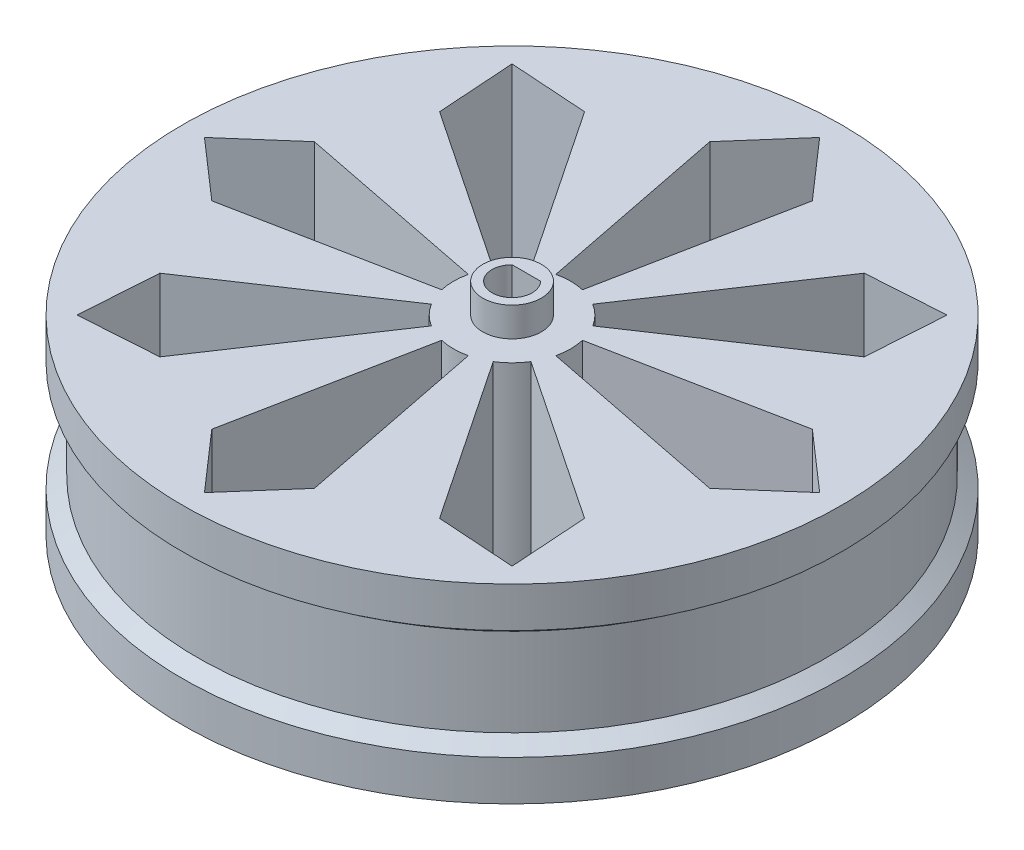
from build123d import *

# Parameters (mm, degrees)
SKETCH1_R           = 45
BOSS_EXTRUDE1_DEPTH = 26
SKETCH2_R           = 4
BOSS_EXTRUDE2_DEPTH = 4
CUT_EXTRUDE2_DEPTH  = 69.745908969
CUT_EXTRUDE4_DEPTH  = 22


with BuildPart() as part:
    # Sketch1 → Boss-Extrude1 (new body)
    with BuildSketch(Plane(origin=(0, 0, 0), x_dir=(1, 0, 0), z_dir=(0, 1, 0))):
        with Locations(Location((0, 0, 0), (0, 0, 90))):
            Circle(SKETCH1_R)
    extrude(amount=BOSS_EXTRUDE1_DEPTH)

    # Sketch2 → Boss-Extrude2 (add)
    with BuildSketch(Plane(origin=(0, 26, 0), x_dir=(1, 0, 0), z_dir=(0, 1, 0))):
        with Locations(Location((0, 0, 0), (0, 0, 270))):
            Circle(SKETCH2_R)
    extrude(amount=BOSS_EXTRUDE2_DEPTH)

    # Sketch4 → Cut-Extrude2 (cut, through all)
    with BuildSketch(Plane(origin=(0, 26, 0), x_dir=(1, 0, 0), z_dir=(0, 1, 0))):
        with BuildLine():
            Line((-1.818379611, 7.790603031), (-7, 34))
            Line((-7, 34), (0, 42))
            Line((0, 42), (7, 34))
            Line((7, 34), (1.818379611, 7.790603031))
            ThreePointArc((1.818379611, 7.790603031), (0, 8), (-1.818379611, 7.790603031))
        make_face()
        with BuildLine():
            Line((4.222999679, 6.794576787), (19.091883092, 28.991378029))
            Line((19.091883092, 28.991378029), (29.69848481, 29.69848481))
            Line((29.69848481, 29.69848481), (28.991378029, 19.091883092))
            Line((28.991378029, 19.091883092), (6.794576787, 4.222999679))
            ThreePointArc((6.794576787, 4.222999679), (5.656854249, 5.656854249), (4.222999679, 6.794576787))
        make_face()
        with BuildLine():
            Line((7.790603031, 1.818379611), (34, 7))
            Line((34, 7), (42, 0))
            Line((42, 0), (34, -7))
            Line((34, -7), (7.790603031, -1.818379611))
            ThreePointArc((7.790603031, -1.818379611), (8, 0), (7.790603031, 1.818379611))
        make_face()
        with BuildLine():
            Line((6.794576787, -4.222999679), (28.991378029, -19.091883092))
            Line((28.991378029, -19.091883092), (29.69848481, -29.69848481))
            Line((29.69848481, -29.69848481), (19.091883092, -28.991378029))
            Line((19.091883092, -28.991378029), (4.222999679, -6.794576787))
            ThreePointArc((4.222999679, -6.794576787), (5.656854249, -5.656854249), (6.794576787, -4.222999679))
        make_face()
        with BuildLine():
            Line((1.818379611, -7.790603031), (7, -34))
            Line((7, -34), (0, -42))
            Line((0, -42), (-7, -34))
            Line((-7, -34), (-1.818379611, -7.790603031))
            ThreePointArc((-1.818379611, -7.790603031), (0, -8), (1.818379611, -7.790603031))
        make_face()
        with BuildLine():
            Line((-4.222999679, -6.794576787), (-19.091883092, -28.991378029))
            Line((-19.091883092, -28.991378029), (-29.69848481, -29.69848481))
            Line((-29.69848481, -29.69848481), (-28.991378029, -19.091883092))
            Line((-28.991378029, -19.091883092), (-6.794576787, -4.222999679))
            ThreePointArc((-6.794576787, -4.222999679), (-5.656854249, -5.656854249), (-4.222999679, -6.794576787))
        make_face()
        with BuildLine():
            Line((-7.790603031, -1.818379611), (-34, -7))
            Line((-34, -7), (-42, 0))
            Line((-42, 0), (-34, 7))
            Line((-34, 7), (-7.790603031, 1.818379611))
            ThreePointArc((-7.790603031, 1.818379611), (-8, 0), (-7.790603031, -1.818379611))
        make_face()
        with BuildLine():
            Line((-6.794576787, 4.222999679), (-28.991378029, 19.091883092))
            Line((-28.991378029, 19.091883092), (-29.69848481, 29.69848481))
            Line((-29.69848481, 29.69848481), (-19.091883092, 28.991378029))
            Line((-19.091883092, 28.991378029), (-4.222999679, 6.794576787))
            ThreePointArc((-4.222999679, 6.794576787), (-5.656854249, 5.656854249), (-6.794576787, 4.222999679))
        make_face()
    extrude(amount=-CUT_EXTRUDE2_DEPTH, mode=Mode.SUBTRACT)

    # Sketch6 → Cut-Revolve4 (revolve, cut)
    with BuildSketch(Plane(origin=(0, 0, 0), x_dir=(0, 0, -1), z_dir=(1, 0, 0)), mode=Mode.PRIVATE) as cut_revolve4_sk:
        Polygon((-45, 20.5), (-43, 19), (-43, 13), (-43, 7), (-45, 5.5), align=None)
    revolve(cut_revolve4_sk.sketch.rotate(Axis((0, 0, 0), (0, 1, 0)), 180), axis=Axis((0, 0, 0), (0, 1, 0)), mode=Mode.SUBTRACT)

    # Sketch9 → Cut-Extrude4 (cut)
    with BuildSketch(Plane(origin=(0, 30, 0), x_dir=(1, 0, 0), z_dir=(0, 1, 0))):
        with BuildLine():
            Line((-1.939071943, 1.95), (1.939071943, 1.95))
            ThreePointArc((1.939071943, 1.95), (0, -2.75), (-1.939071943, 1.95))
        make_face()
    extrude(amount=-CUT_EXTRUDE4_DEPTH, mode=Mode.SUBTRACT)


solid = part.part
